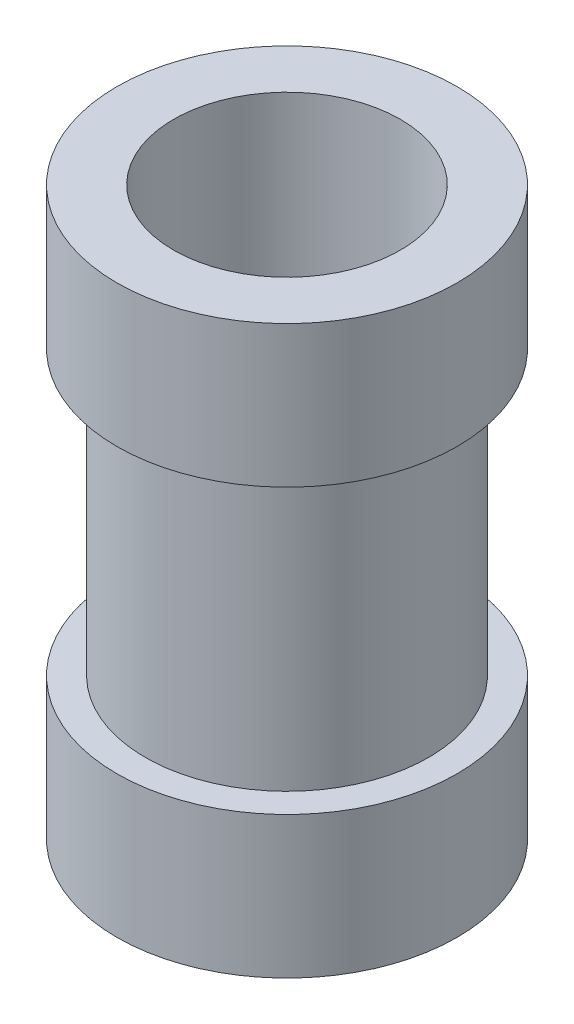
from build123d import *

# Parameters (mm, degrees)
SKETCH2_R          = 2
CUT_EXTRUDE1_DEPTH = 11.862780491


with BuildPart() as part:
    # Sketch1 → Revolve1 (revolve)
    with BuildSketch(Plane.XY, mode=Mode.PRIVATE) as revolve1_sk:
        Polygon((0, 0), (0, 5), (-3, 5), (-3, 2.5), (-2.5, 2.5), (-2.5, 0), align=None)
    revolve1 = revolve(revolve1_sk.sketch.rotate(Axis((0, 0, 0), (0, 1, 0)), 270), axis=Axis((0, 0, 0), (0, 1, 0)))

    # Mirror1: Revolve1 across plane
    add(revolve1.mirror(Plane(origin=(-2.5, 0, 0), x_dir=(0, 0, 1), z_dir=(0, 1, 0))))

    # Sketch2 → Cut-Extrude1 (cut, through all)
    with BuildSketch(Plane(origin=(0, 5, 0), x_dir=(1, 0, 0), z_dir=(0, 1, 0))):
        with Locations(Location((0, 0, 0), (0, 0, 270))):
            Circle(SKETCH2_R)
    extrude(amount=-CUT_EXTRUDE1_DEPTH, mode=Mode.SUBTRACT)


solid = part.part
